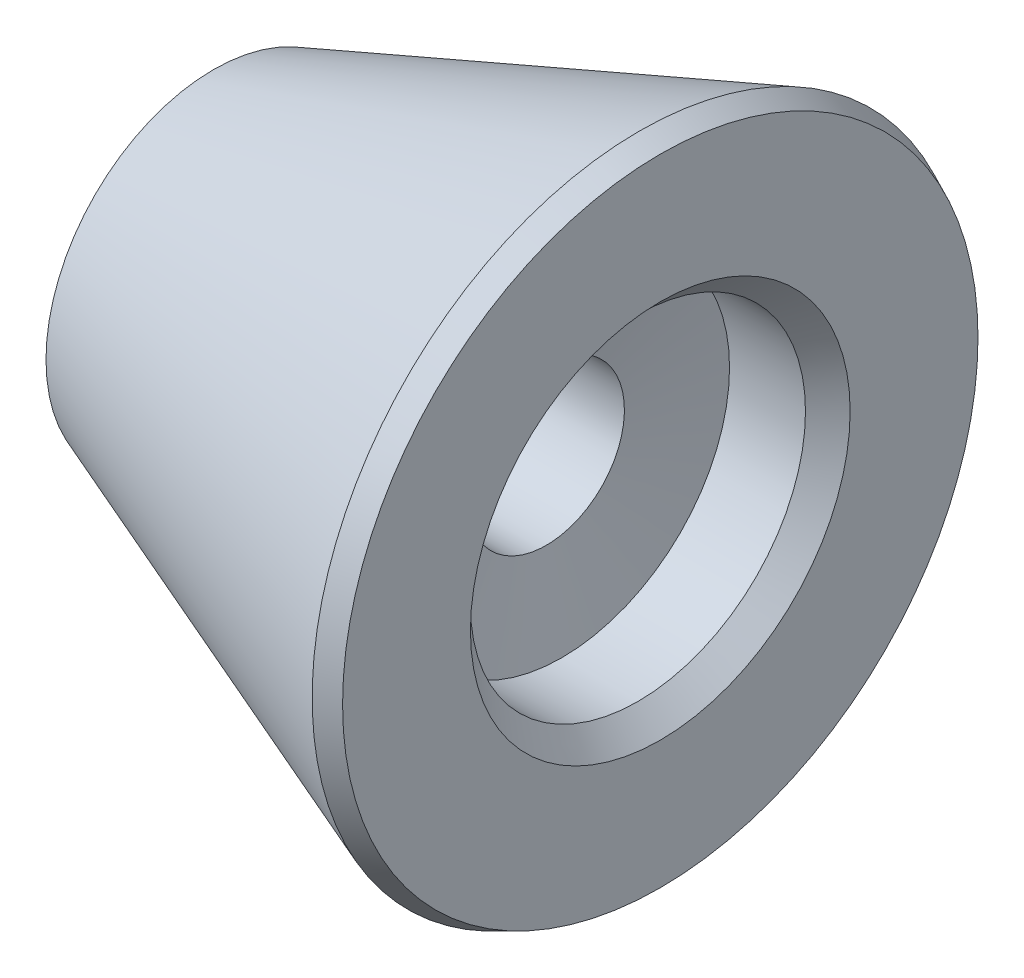
from build123d import *
from OCP.BRepFilletAPI import BRepFilletAPI_MakeChamfer

# Parameters (mm, degrees)
CORTAR_EXTRUIR1_DEPTH = 5.2
CHAFL_N1_SIZE         = 1
CHAFL_N1_SIZE2        = 0.776727613


with BuildPart() as part:
    # Croquis1 → Revolución1 (revolve)
    with BuildSketch(Plane(origin=(0, 0, 0), x_dir=(0, 1, 0), z_dir=(0, 0, 1))):
        Polygon((7.5, -10), (15, -10), (7.5, 10), (3.5, 10), (3.5, -4.894692077), (7.5, -5.6), align=None)
    revolve(axis=Axis((0, 0, 0), (-1, 0, 0)))

    # Croquis2 → Cortar-Extruir1 (cut)
    with BuildSketch(Plane(origin=(-10, 0, 0), x_dir=(0, -1, 0), z_dir=(-1, 0, 0))):
        Polygon((3.059956427, -5.3), (6.119912853, 0), (3.059956427, 5.3), (-3.059956427, 5.3), (-6.119912853, 0), (-3.059956427, -5.3), align=None)
    extrude(amount=-CORTAR_EXTRUIR1_DEPTH, mode=Mode.SUBTRACT)

    # Chaflán1: one chamfer whose edges measure the first distance from different faces: ONE call of the kernel's chamfer builder (chamfer() names one face for all edges)
    chafl_n1_edges_1 = [part.edges().sort_by_distance(p)[0] for p in [
        (10, -7.5, 0),
    ]]
    chafl_n1_edges_2 = [part.edges().sort_by_distance(p)[0] for p in [
        (10, -15, 0),
    ]]
    chafl_n1_side_2 = [part.faces().sort_by_distance(p)[0] for p in [
        (0, -11.25, 0),
    ]]
    chafl_n1 = BRepFilletAPI_MakeChamfer(part.part.solid().wrapped)
    for e in chafl_n1_edges_1:
        chafl_n1.Add(CHAFL_N1_SIZE, e.wrapped)
    for e in chafl_n1_edges_2:
        chafl_n1.Add(CHAFL_N1_SIZE, CHAFL_N1_SIZE2, e.wrapped, chafl_n1_side_2[0].wrapped)  # the first distance lies on this face
    add(Compound.cast(chafl_n1.Shape()), mode=Mode.REPLACE)


solid = part.part
